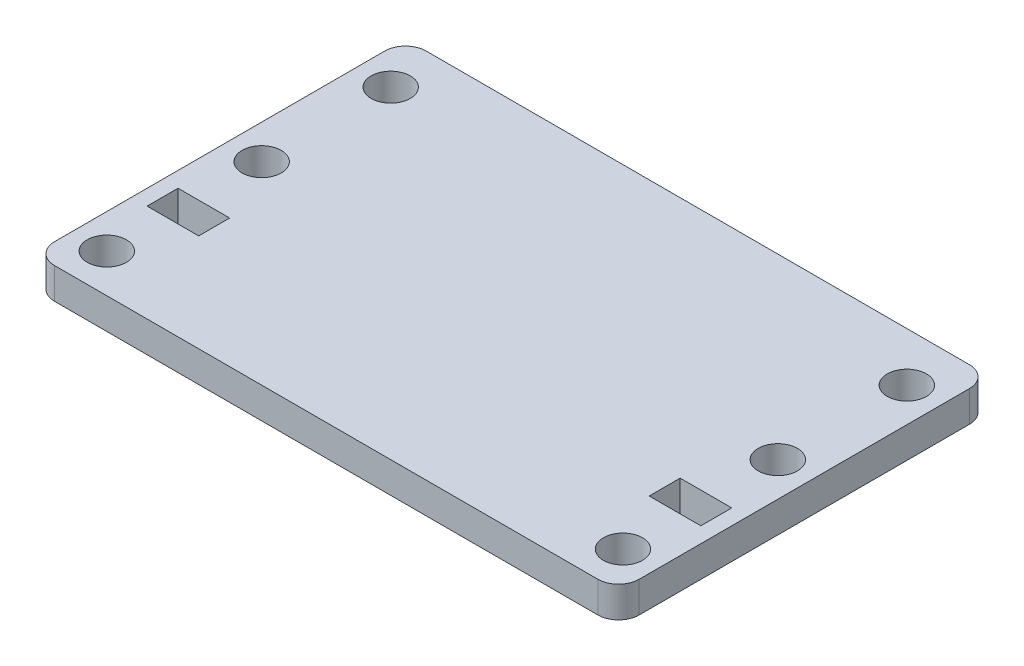
from build123d import *

# Parameters (mm, degrees)
SKETCH1_W             = 56.64
SKETCH1_H             = 36
BOSS_EXTRUDE1_DEPTH   = 3
F_6_CLEARANCE_HOLE2_D = 3.7973
SKETCH7_W             = 5
SKETCH7_H             = 3
CUT_EXTRUDE1_DEPTH    = 10
FILLET1_R             = 2


with BuildPart() as part:
    # Sketch1 → Boss-Extrude1 (new body)
    with BuildSketch(Plane(origin=(0, 0, 0), x_dir=(1, 0, 0), z_dir=(0, 1, 0))):
        with Locations((-28.32, 18)):
            Rectangle(SKETCH1_W, SKETCH1_H)
    extrude(amount=BOSS_EXTRUDE1_DEPTH)

    # #6 Clearance Hole2 (through all)
    with Locations(Plane(origin=(0, 3, 0), x_dir=(1, 0, 0), z_dir=(0, 1, 0))):
        with Locations((-53.32, 31.25), (-53.32, 18.75), (-53.32, 3.75), (-3.32, 31.25), (-3.32, 18.75), (-3.32, 3.75)):
            Hole(F_6_CLEARANCE_HOLE2_D / 2)

    # Sketch7 → Cut-Extrude1 (cut)
    with BuildSketch(Plane(origin=(0, 3, 0), x_dir=(1, 0, 0), z_dir=(0, 1, 0))):
        with Locations((-52.64, 10.97)):
            Rectangle(SKETCH7_W, SKETCH7_H)
        with Locations((-4, 10.97)):
            Rectangle(SKETCH7_W, SKETCH7_H)
    extrude(amount=-CUT_EXTRUDE1_DEPTH, mode=Mode.SUBTRACT)

    # Fillet1
    fillet1_edges = [part.edges().sort_by_distance(p)[0] for p in [
        (0, 1.5, 0),
        (-56.64, 1.5, 0),
        (-56.64, 1.5, -36),
        (0, 1.5, -36),
    ]]
    fillet(fillet1_edges, radius=FILLET1_R)


solid = part.part
